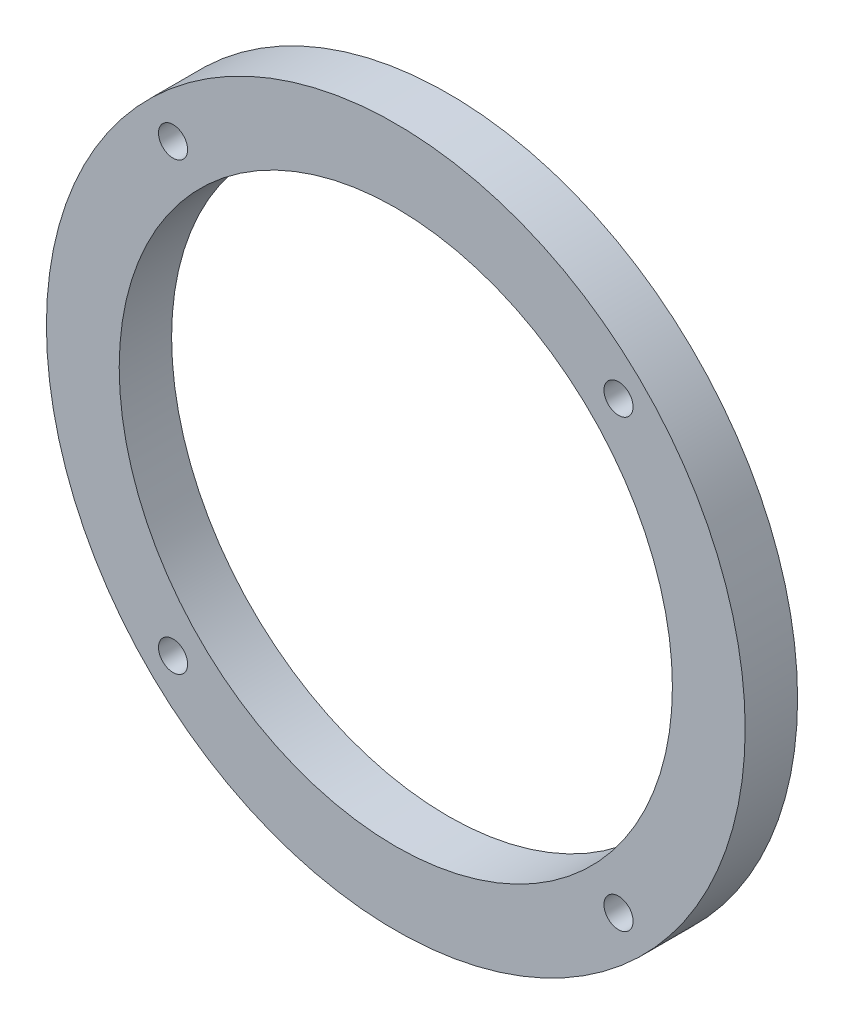
from build123d import *

# Parameters (mm, degrees)
SKETCH_1_R          = 60
SKETCH_1_R_2        = 47.5
EXTRUDE_1_DEPTH     = 9
SKETCH_2_R          = 2.5
CUT_EXTRUDE_1_DEPTH = 10


with BuildPart() as part:
    # 草图1 → 凸台-拉伸1 (new body)
    with BuildSketch(Plane.XY):
        Circle(SKETCH_1_R)
        Circle(SKETCH_1_R_2, mode=Mode.SUBTRACT)
    extrude(amount=EXTRUDE_1_DEPTH)

    # 草图2 → 切除-拉伸1 (cut)
    with BuildSketch(Plane.XY.offset(9)):
        with Locations((38.25, 38.25)):
            Circle(SKETCH_2_R)
        with Locations((38.25, -38.25)):
            Circle(SKETCH_2_R)
        with Locations((-38.25, -38.25)):
            Circle(SKETCH_2_R)
        with Locations((-38.25, 38.25)):
            Circle(SKETCH_2_R)
    extrude(amount=-CUT_EXTRUDE_1_DEPTH, mode=Mode.SUBTRACT)


solid = part.part
